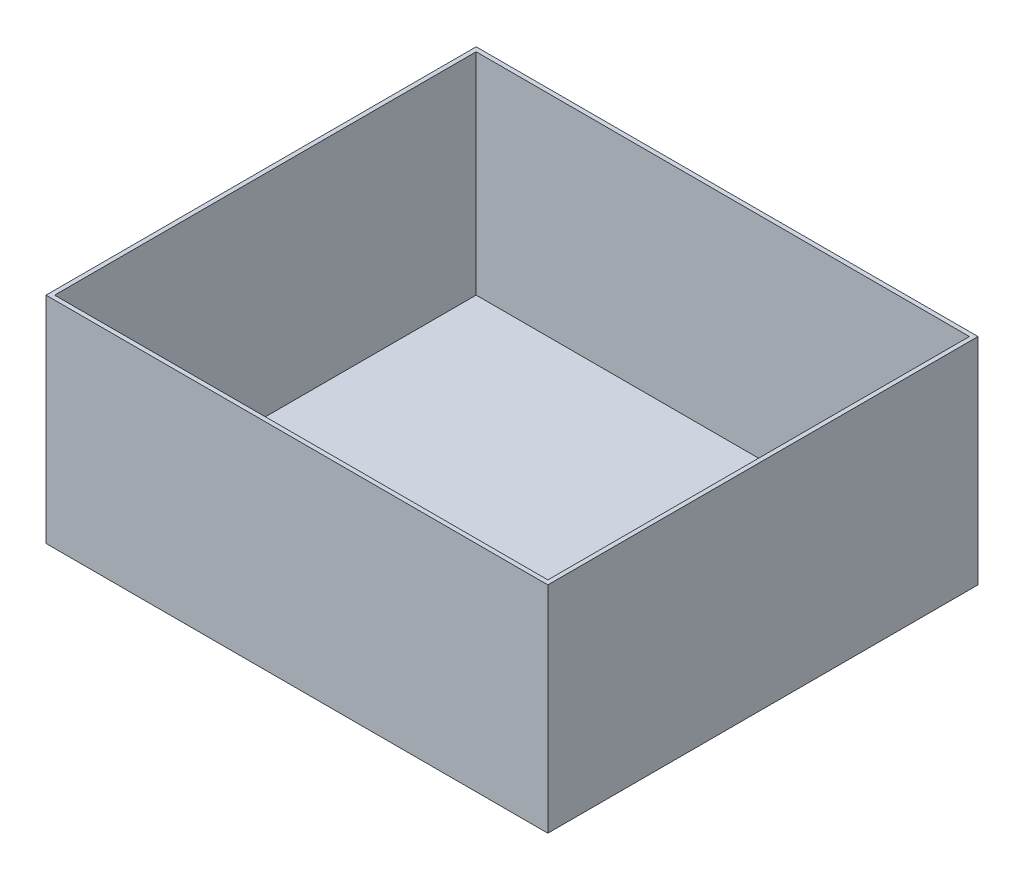
from build123d import *

# Parameters (mm, degrees)
SKETCH_1_W        = 350
SKETCH_1_H        = 300
SKETCH_1_W_2      = 344
SKETCH_1_H_2      = 294
EXTRUDE_1_DEPTH   = 150
SKETCH_2_W        = 350
SKETCH_2_H        = 300
EXTRUDE_1_2_DEPTH = 3


with BuildPart() as part:
    # 草图1 → Extrude 1 (new body)
    with BuildSketch(Plane(origin=(0, 0, 0), x_dir=(1, 0, 0), z_dir=(0, 1, 0))):
        Rectangle(SKETCH_1_W, SKETCH_1_H)
        Rectangle(SKETCH_1_W_2, SKETCH_1_H_2, mode=Mode.SUBTRACT)
    extrude(amount=EXTRUDE_1_DEPTH)

    # 草图2 → Extrude 1 2 (add)
    with BuildSketch(Plane.XZ):
        Rectangle(SKETCH_2_W, SKETCH_2_H)
    extrude(amount=-EXTRUDE_1_2_DEPTH)


solid = part.part
